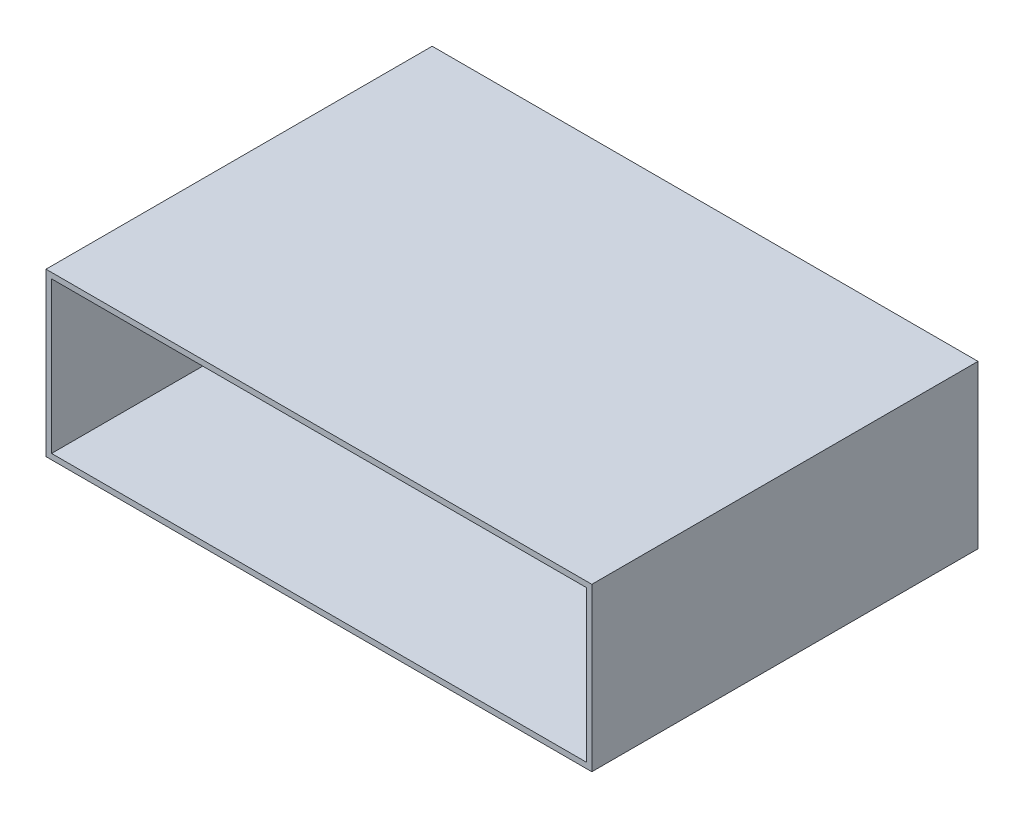
from build123d import *

# Parameters (mm, degrees)
SKETCH1_W           = 310.8125
SKETCH1_H           = 92.455
SKETCH1_W_2         = 304.4625
SKETCH1_H_2         = 86.105
BOSS_EXTRUDE1_DEPTH = 219.9
SKETCH1_2_W         = 304.4625
SKETCH1_2_H         = 86.105
BOSS_EXTRUDE2_DEPTH = 3.175


with BuildPart() as part:
    # Sketch1 → Boss-Extrude1 (new body)
    with BuildSketch(Plane.XY):
        Rectangle(SKETCH1_W, SKETCH1_H)
        Rectangle(SKETCH1_W_2, SKETCH1_H_2, mode=Mode.SUBTRACT)
    extrude(amount=BOSS_EXTRUDE1_DEPTH)

    # Sketch1<2> → Boss-Extrude2 (add)
    with BuildSketch(Plane.XY):
        Rectangle(SKETCH1_2_W, SKETCH1_2_H)
    extrude(amount=BOSS_EXTRUDE2_DEPTH)


solid = part.part
